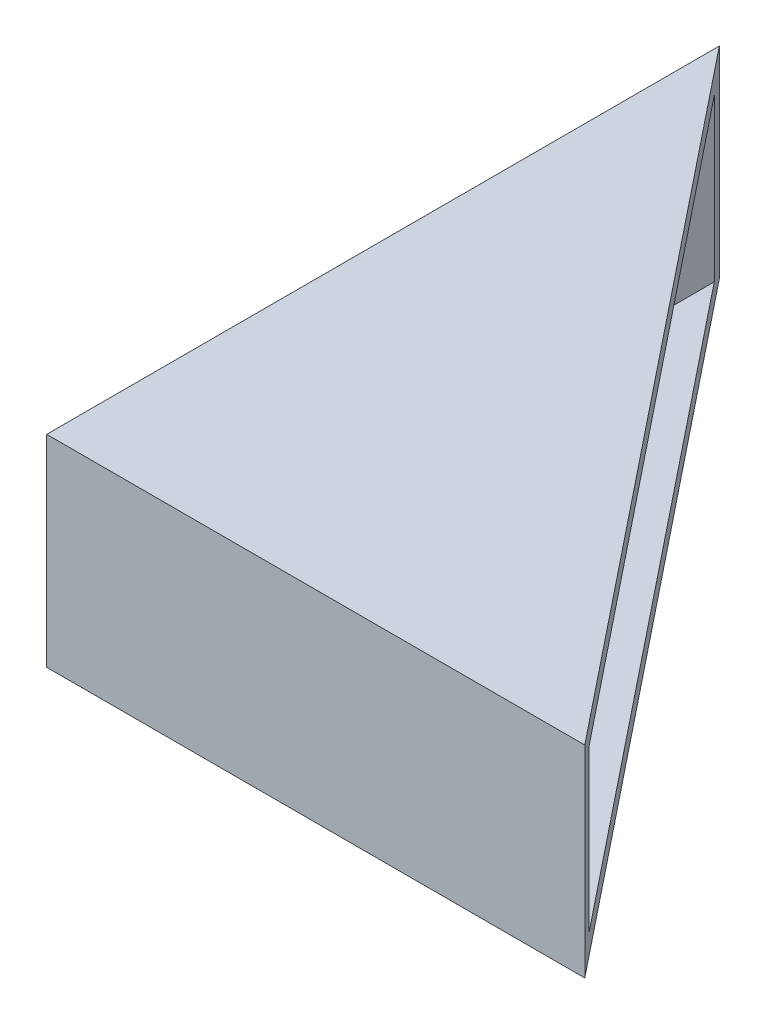
from build123d import *

# Parameters (mm, degrees)
BOSS_EXTRUDE1_DEPTH = 30
SHELL1_T            = -3
SKETCH2_R           = 1.75
CUT_EXTRUDE1_DEPTH  = 10


with BuildPart() as part:
    # Sketch1 → Boss-Extrude1 (new body)
    with BuildSketch(Plane(origin=(0, 0, 0), x_dir=(1, 0, 0), z_dir=(0, 1, 0))):
        Polygon((0, 0), (80, 0), (0, 100), align=None)
    extrude(amount=BOSS_EXTRUDE1_DEPTH)

    # Shell1
    shell1_openings = [part.faces().sort_by_distance(p)[0] for p in [
        (40, 15, -50),
    ]]
    offset(amount=SHELL1_T, openings=shell1_openings, kind=Kind.INTERSECTION)

    # Sketch2 → Cut-Extrude1 (cut)
    with BuildSketch(Plane.ZY):
        with Locations((-15, 15)):
            Circle(SKETCH2_R)
        with Locations((-40, 15)):
            Circle(SKETCH2_R)
        with Locations((-65, 15)):
            Circle(SKETCH2_R)
        with Locations((-90, 15)):
            Circle(SKETCH2_R)
    extrude(amount=-CUT_EXTRUDE1_DEPTH, mode=Mode.SUBTRACT)


solid = part.part
